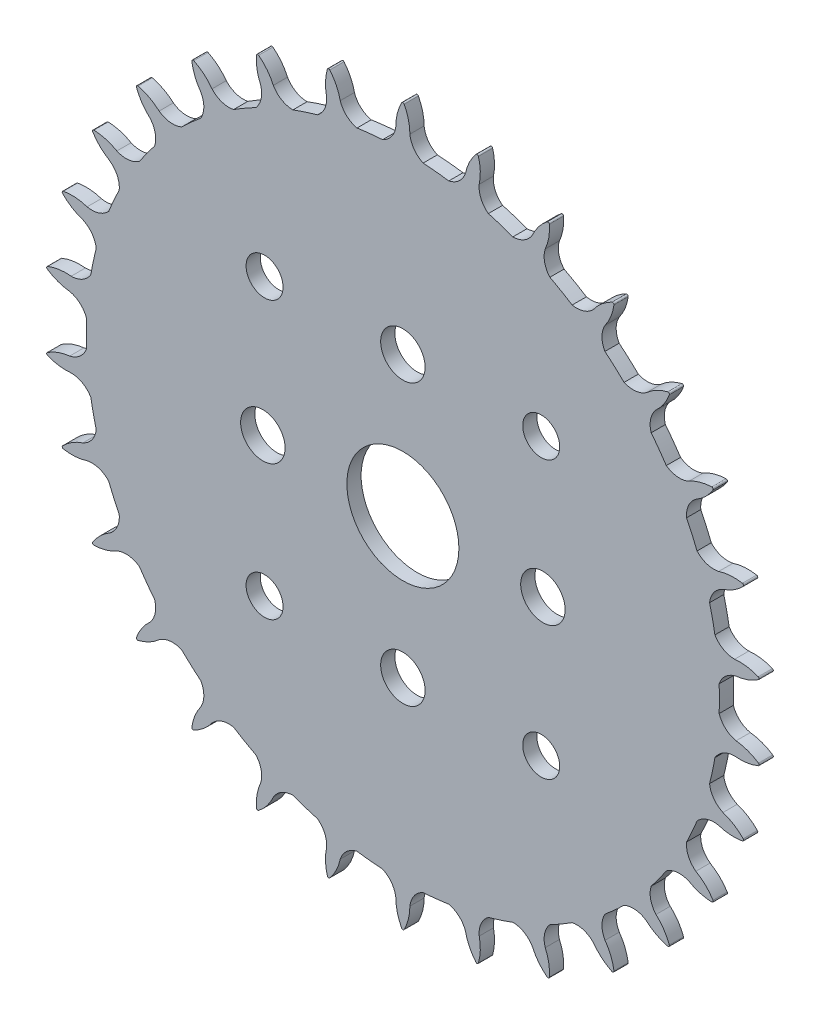
from build123d import *

# Parameters (mm, degrees)
SKETCH1_R           = 22.6042
SKETCH1_R_2         = 1.5875
SKETCH1_R_3         = 1.3208
SKETCH1_R_4         = 4
BOSS_EXTRUDE2_DEPTH = 1.016
BOSS_EXTRUDE4_DEPTH = 1.016
CIRPATTERN1_COUNT   = 30


with BuildPart() as part:
    # Sketch1 → Boss-Extrude2 (new body)
    with BuildSketch(Plane.XY):
        Circle(SKETCH1_R)
        with Locations((0, 10)):
            Circle(SKETCH1_R_2, mode=Mode.SUBTRACT)
        with Locations((9.878281733, -9.878281733)):
            Circle(SKETCH1_R_3, mode=Mode.SUBTRACT)
        with Locations((9.878281733, 9.878281733)):
            Circle(SKETCH1_R_3, mode=Mode.SUBTRACT)
        with Locations((-9.878281733, -9.878281733)):
            Circle(SKETCH1_R_3, mode=Mode.SUBTRACT)
        with Locations((-9.878281733, 9.878281733)):
            Circle(SKETCH1_R_3, mode=Mode.SUBTRACT)
        Circle(SKETCH1_R_4, mode=Mode.SUBTRACT)
        with Locations((10, 0)):
            Circle(SKETCH1_R_2, mode=Mode.SUBTRACT)
        with Locations((0, -10)):
            Circle(SKETCH1_R_2, mode=Mode.SUBTRACT)
        with Locations((-10, 0)):
            Circle(SKETCH1_R_2, mode=Mode.SUBTRACT)
    extrude(amount=BOSS_EXTRUDE2_DEPTH)

    # Sketch2 → Boss-Extrude4 (add)
    with BuildSketch(Plane.XY.offset(1.016)):
        with BuildLine():
            ThreePointArc((0.499966183, 23.87339923), (0.395489673, 24.72361552), (0.088276676, 25.523242468))
            ThreePointArc((0.088276676, 25.523242468), (0, 25.576261319), (-0.088276676, 25.523242468))
            ThreePointArc((-0.088276676, 25.523242468), (-0.395489673, 24.72361552), (-0.499966183, 23.87339923))
            ThreePointArc((-0.499966183, 23.87339923), (-0.860366222, 23.007508861), (-1.639123068, 22.48483105))
            ThreePointArc((-1.639123068, 22.48483105), (-3.604e-06, 22.25516725), (1.63911586, 22.48483105))
            ThreePointArc((1.63911586, 22.48483105), (0.860363257, 23.007510471), (0.499966183, 23.87339923))
        make_face()
    boss_extrude4 = extrude(amount=-BOSS_EXTRUDE4_DEPTH)

    # CirPattern1: Boss-Extrude4 ×30 about axis
    cirpattern1_axis = Axis((0, 0, 0), (0, 0, 1))
    for i in range(1, CIRPATTERN1_COUNT):
        add(boss_extrude4.rotate(cirpattern1_axis, i * 360 / CIRPATTERN1_COUNT))


solid = part.part
